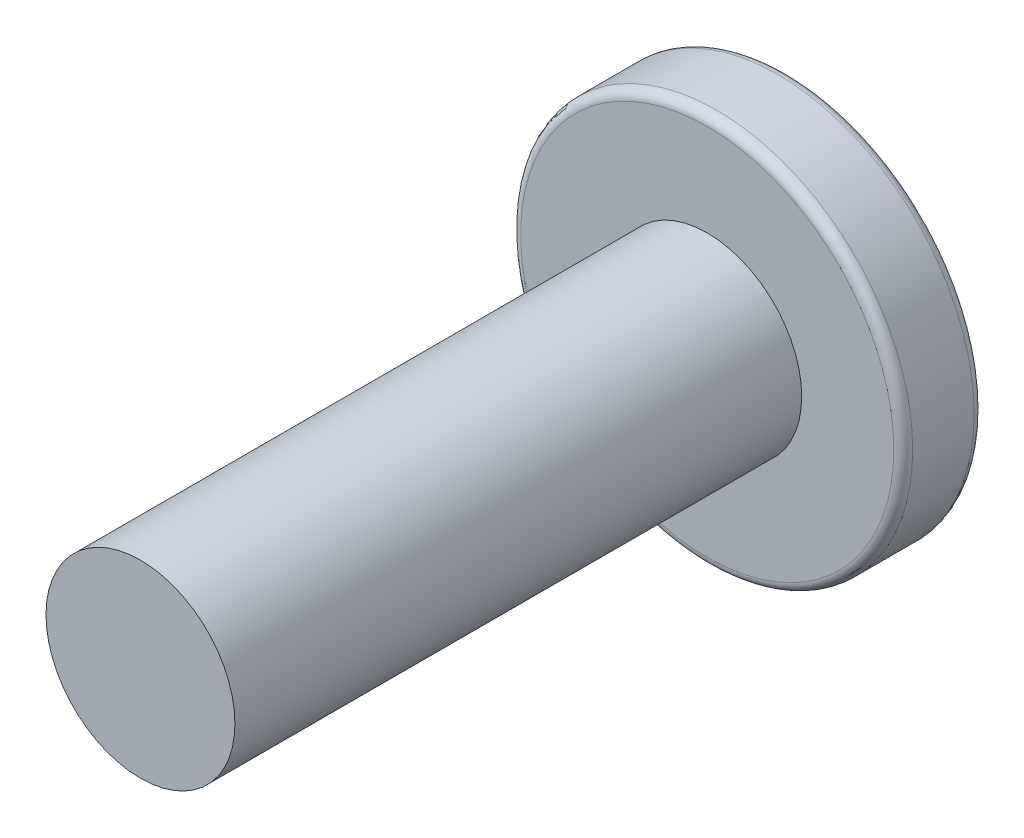
from build123d import *

# Parameters (mm, degrees)
SKETCH_1_R          = 4.15
EXTRUDE_1_DEPTH     = 1.7
SKETCH_2_R          = 2
EXTRUDE_2_DEPTH     = 12
FILLET_1_R          = 0.2
CUT_EXTRUDE_1_DEPTH = 1.5


with BuildPart() as part:
    # 草图1 → 凸台-拉伸1 (new body)
    with BuildSketch(Plane.XY):
        Circle(SKETCH_1_R)
    extrude(amount=EXTRUDE_1_DEPTH)

    # 草图2 → 凸台-拉伸2 (add)
    with BuildSketch(Plane.XY.offset(1.7)):
        Circle(SKETCH_2_R)
    extrude(amount=EXTRUDE_2_DEPTH)

    # 圆角1
    fillet_1_edges = [part.edges().sort_by_distance(p)[0] for p in [
        (-4.15, 0, 0),
        (-4.15, 0, 1.7),
    ]]
    fillet(fillet_1_edges, radius=FILLET_1_R)

    # 草图3 → 切除-拉伸1 (cut)
    with BuildSketch(Plane(origin=(0, 0, 0), x_dir=(-1, 0, 0), z_dir=(0, 0, -1))):
        Polygon((1.154700538, 0), (0.577350269, 1), (-0.577350269, 1), (-1.154700538, 0), (-0.577350269, -1), (0.577350269, -1), align=None)
    extrude(amount=-CUT_EXTRUDE_1_DEPTH, mode=Mode.SUBTRACT)


solid = part.part
